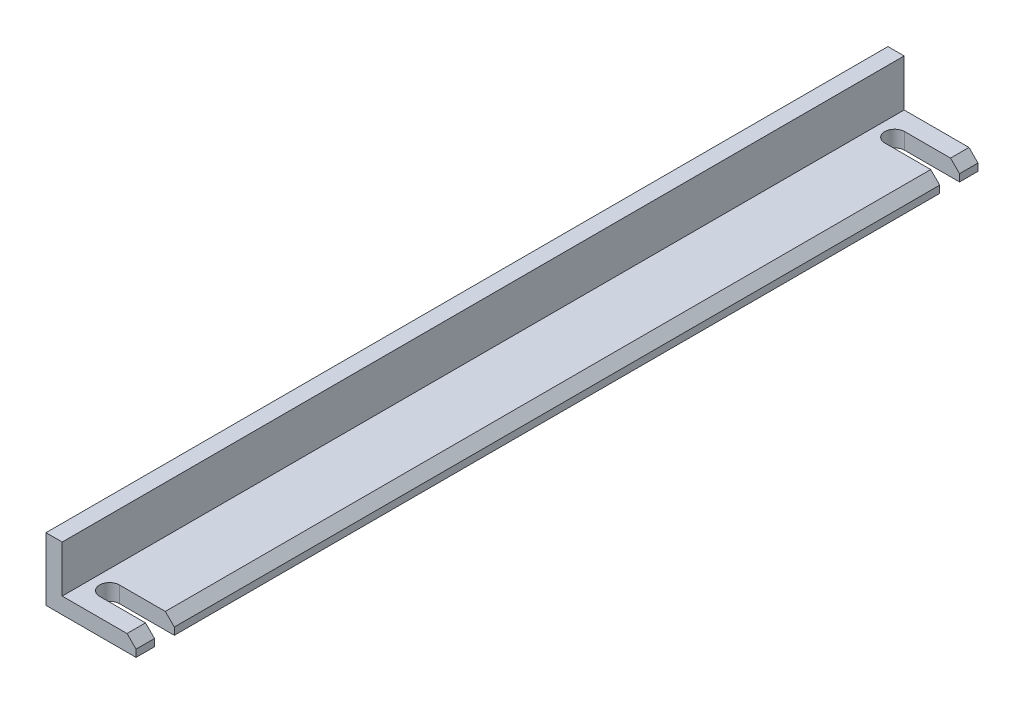
from build123d import *

# Parameters (mm, degrees)
EXTRUDE_THIN1_DEPTH = 46.75
CHAMFER1_SIZE       = 1
CUT_EXTRUDE1_DEPTH  = 10


with BuildPart() as part:
    # Sketch1 → Extrude-Thin1 (new, symmetric)
    with BuildSketch(Plane.XY):
        Polygon((10, 0), (0, 0), (0, 7), (1.8, 7), (1.8, 1.8), (10, 1.8), align=None)
    extrude(amount=EXTRUDE_THIN1_DEPTH, both=True)

    # Chamfer1
    chamfer1_edges = [part.edges().sort_by_distance(p)[0] for p in [
        (10, 1.8, 0),
    ]]
    chamfer(chamfer1_edges, length=CHAMFER1_SIZE)

    # Sketch2 → Cut-Extrude1 (cut)
    with BuildSketch(Plane(origin=(0, 1.8, 0), x_dir=(1, 0, 0), z_dir=(0, 1, 0))):
        with BuildLine():
            Line((11.522549571, -44.7), (3.9, -44.7))
            ThreePointArc((3.9, -44.7), (2.8, -43.6), (3.9, -42.5))
            Line((3.9, -42.5), (11.522549571, -42.5))
            ThreePointArc((11.522549571, -42.5), (12.622549571, -43.6), (11.522549571, -44.7))
        make_face()
    cut_extrude1 = extrude(amount=-CUT_EXTRUDE1_DEPTH, mode=Mode.SUBTRACT)

    # Mirror1: Cut-Extrude1 across plane
    add(cut_extrude1.mirror(Plane.XY), mode=Mode.SUBTRACT)


solid = part.part
